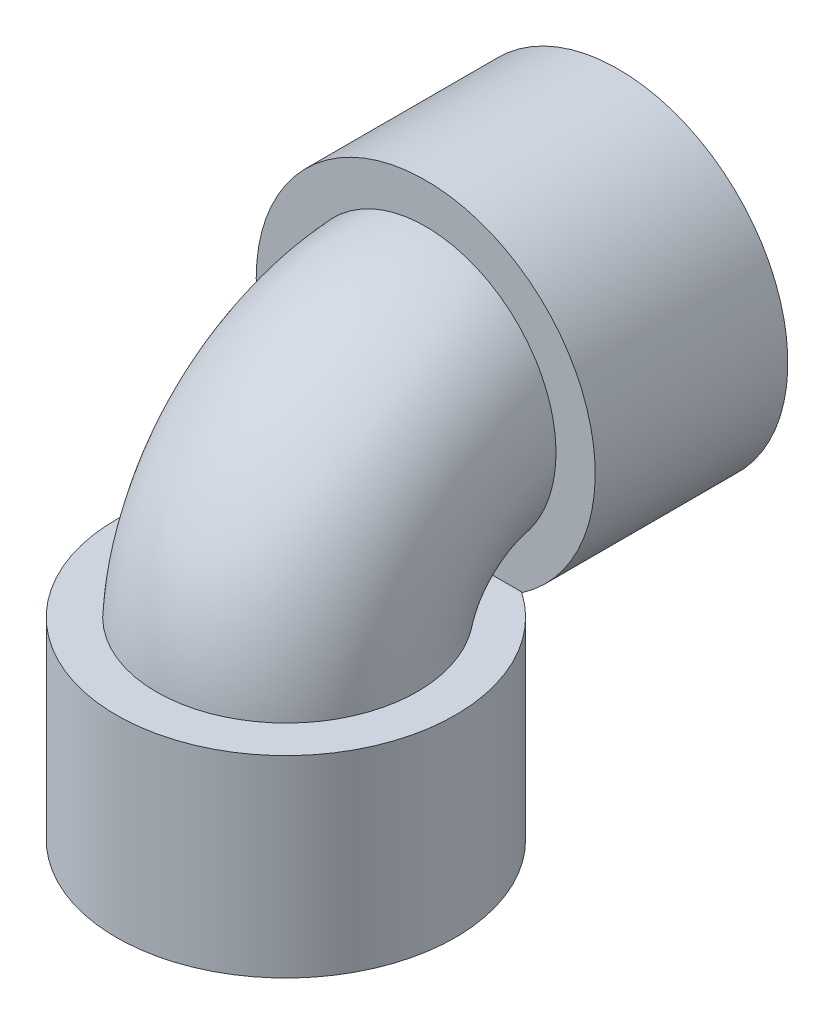
from build123d import *

# Parameters (mm, degrees)
ESQUISSE1_R             = 16.9
ESQUISSE1_R_2           = 13.9
R_VOL_MINCE1_ANGLE      = 90
ESQUISSE2_R             = 15.9
ESQUISSE2_R_2           = 13.9
EXTRU_MINCE1_DEPTH      = 22.4
ESQUISSE3_R             = 18.1
ESQUISSE3_R_2           = 16.1
EXTRU_MINCE2_DEPTH      = 22.3
CROQUIS1_R              = 22
CROQUIS1_R_2            = 13.9
SALIENTE_EXTRUIR1_DEPTH = 25
SALIENTE_EXTRUIR2_START = -25
CROQUIS2_R              = 22
CROQUIS2_R_2            = 13.9
SALIENTE_EXTRUIR2_DEPTH = 25


with BuildPart() as part:
    # Esquisse1 → Révol.-Mince1 (revolve)
    with BuildSketch(Plane.XY):
        Circle(ESQUISSE1_R)
        Circle(ESQUISSE1_R_2, mode=Mode.SUBTRACT)
    revolve(axis=Axis((0, -20.745281933, 0), (1, 0, 0)), revolution_arc=R_VOL_MINCE1_ANGLE)

    # Esquisse2 → Extru.-Mince1 (add)
    with BuildSketch(Plane(origin=(0, 0, 0), x_dir=(-1, 0, 0), z_dir=(0, 0, -1))):
        Circle(ESQUISSE2_R)
        Circle(ESQUISSE2_R_2, mode=Mode.SUBTRACT)
    extrude(amount=EXTRU_MINCE1_DEPTH)

    # Esquisse3 → Extru.-Mince2 (add)
    with BuildSketch(Plane.XZ.offset(20.745281933)):
        with Locations((0, 20.745281933)):
            Circle(ESQUISSE3_R)
        with Locations((0, 20.745281933)):
            Circle(ESQUISSE3_R_2, mode=Mode.SUBTRACT)
    extrude(amount=EXTRU_MINCE2_DEPTH)

    # Croquis1 → Saliente-Extruir1 (add)
    with BuildSketch(Plane.XZ.offset(43.045281933)):
        with Locations(Location((0, 20.745281933, 0), (0, 0, 270))):
            Circle(CROQUIS1_R)
        with Locations(Location((0, 20.745281933, 0), (0, 0, 270))):
            Circle(CROQUIS1_R_2, mode=Mode.SUBTRACT)
    extrude(amount=-SALIENTE_EXTRUIR1_DEPTH)

    # Croquis2 → Saliente-Extruir2 (add)
    with BuildSketch(Plane(origin=(0, 0, -22.4), x_dir=(-1, 0, 0), z_dir=(0, 0, -1)).offset(SALIENTE_EXTRUIR2_START)):
        Circle(CROQUIS2_R)
        Circle(CROQUIS2_R_2, mode=Mode.SUBTRACT)
    extrude(amount=SALIENTE_EXTRUIR2_DEPTH)


solid = part.part
